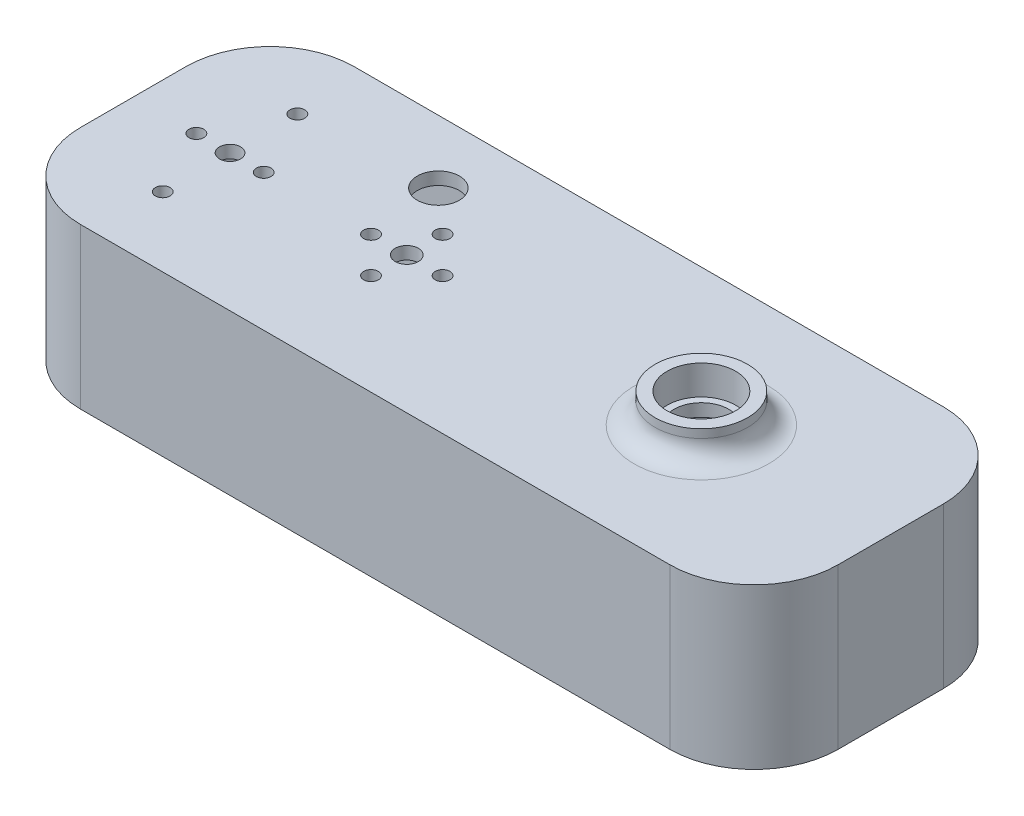
from build123d import *

# Parameters (mm, degrees)
SALIENTE_EXTRUIR1_DEPTH          = 35
SALIENTE_EXTRUIR2_DEPTH          = 35
CROQUIS3_W                       = 180
CROQUIS3_H                       = 65
SALIENTE_EXTRUIR3_DEPTH          = 3
REDONDEO1_R                      = 20
CROQUIS5_R                       = 2.5
CROQUIS5_R_2                     = 2.75
CORTAR_EXTRUIR1_DEPTH            = 3
CORTAR_EXTRUIR3_REACH            = 103.888
CROQUIS7_R                       = 1.75
TALADRO_DE_MARGEN_PARA_M31_D     = 3.4
TALADRO_DE_MARGEN_PARA_M31_DEPTH = 30
TALADRO_DE_MARGEN_PARA_M31_TIP   = 1.021463052
CORTAR_EXTRUIR4_REACH            = 104.958
CROQUIS10_R                      = 1.75
CROQUIS11_R                      = 5
CORTAR_EXTRUIR5_DEPTH            = 10
CROQUIS12_R                      = 6.5
CORTAR_EXTRUIR6_DEPTH            = 10
CROQUIS13_R                      = 11
CROQUIS13_R_2                    = 8.15
SALIENTE_EXTRUIR4_DEPTH          = 7
REDONDEO2_R                      = 5


with BuildPart() as part:
    # Croquis1 → Saliente-Extruir1 (new body)
    with BuildSketch(Plane(origin=(0, 0, 0), x_dir=(1, 0, 0), z_dir=(0, 1, 0))):
        Polygon((90, -32.5), (90, 0), (87, 0), (87, -29.5), (-87, -29.5), (-87, 0), (-90, 0), (-90, -32.5), align=None)
        Polygon((87, 0), (90, 0), (90, 32.5), (-90, 32.5), (-90, 0), (-87, 0), (-87, 29.5), (87, 29.5), align=None)
    extrude(amount=SALIENTE_EXTRUIR1_DEPTH)

    # Croquis2 → Saliente-Extruir2 (add)
    with BuildSketch(Plane(origin=(0, 35, 0), x_dir=(1, 0, 0), z_dir=(0, 1, 0))):
        Polygon((87, 29.5), (67, 29.5), (87, 9.5), align=None)
        Polygon((-67, 29.5), (-87, 9.5), (-87, 29.5), align=None)
        Polygon((67, -29.5), (87, -9.5), (87, -29.5), align=None)
        Polygon((-87, -29.5), (-67, -29.5), (-87, -9.5), align=None)
    extrude(amount=-SALIENTE_EXTRUIR2_DEPTH)

    # Croquis3 → Saliente-Extruir3 (add)
    with BuildSketch(Plane(origin=(0, 35, 0), x_dir=(1, 0, 0), z_dir=(0, 1, 0))):
        Rectangle(CROQUIS3_W, CROQUIS3_H)
    extrude(amount=SALIENTE_EXTRUIR3_DEPTH)

    # Redondeo1
    redondeo1_edges = [part.edges().sort_by_distance(p)[0] for p in [
        (90, 19, -32.5),
        (90, 19, 32.5),
        (-90, 19, 32.5),
        (-90, 19, -32.5),
    ]]
    fillet(redondeo1_edges, radius=REDONDEO1_R)

    # Croquis5 → Cortar-Extruir1 (cut)
    with BuildSketch(Plane.XZ.offset(-35)):
        with Locations(Location((-67, 0, 0), (0, 0, 270))):
            Circle(CROQUIS5_R)
        with Locations(Location((-25, 0, 0), (0, 0, 270))):
            Circle(CROQUIS5_R_2)
        with Locations(Location((45, 0, 0), (0, 0, 270))):
            Circle(CROQUIS5_R_2)
    extrude(amount=-CORTAR_EXTRUIR1_DEPTH, mode=Mode.SUBTRACT)

    # Croquis7 → Cortar-Extruir3 (cut, up to next)
    with BuildSketch(Plane.XZ.offset(-35), mode=Mode.PRIVATE) as cortar_extruir3_sk1:
        with Locations(Location((-67, 16, 0), (0, 0, 270))):
            Circle(CROQUIS7_R)
    cortar_extruir3_tool1 = extrude(cortar_extruir3_sk1.sketch, amount=-CORTAR_EXTRUIR3_REACH, mode=Mode.PRIVATE) & part.part
    # Croquis7 → Cortar-Extruir3 (cut, up to next)
    with BuildSketch(Plane.XZ.offset(-35), mode=Mode.PRIVATE) as cortar_extruir3_sk2:
        with Locations(Location((-59, 0, 0), (0, 0, 270))):
            Circle(CROQUIS7_R)
    cortar_extruir3_tool2 = extrude(cortar_extruir3_sk2.sketch, amount=-CORTAR_EXTRUIR3_REACH, mode=Mode.PRIVATE) & part.part
    # Croquis7 → Cortar-Extruir3 (cut, up to next)
    with BuildSketch(Plane.XZ.offset(-35), mode=Mode.PRIVATE) as cortar_extruir3_sk3:
        with Locations(Location((-67, -16, 0), (0, 0, 270))):
            Circle(CROQUIS7_R)
    cortar_extruir3_tool3 = extrude(cortar_extruir3_sk3.sketch, amount=-CORTAR_EXTRUIR3_REACH, mode=Mode.PRIVATE) & part.part
    # Croquis7 → Cortar-Extruir3 (cut, up to next)
    with BuildSketch(Plane.XZ.offset(-35), mode=Mode.PRIVATE) as cortar_extruir3_sk4:
        with Locations(Location((-75, 0, 0), (0, 0, 270))):
            Circle(CROQUIS7_R)
    cortar_extruir3_tool4 = extrude(cortar_extruir3_sk4.sketch, amount=-CORTAR_EXTRUIR3_REACH, mode=Mode.PRIVATE) & part.part
    add(cortar_extruir3_tool1.solids().sort_by_distance((-67, 35, 16))[0], mode=Mode.SUBTRACT)
    add(cortar_extruir3_tool2.solids().sort_by_distance((-59, 35, 0))[0], mode=Mode.SUBTRACT)
    add(cortar_extruir3_tool3.solids().sort_by_distance((-67, 35, -16))[0], mode=Mode.SUBTRACT)
    add(cortar_extruir3_tool4.solids().sort_by_distance((-75, 35, 0))[0], mode=Mode.SUBTRACT)

    # Taladro de margen para M31
    with Locations(Plane.XZ):
        with Locations((-80, 22.5), (80, 22.5), (-80, -22.5), (80, -22.5)):
            Hole(TALADRO_DE_MARGEN_PARA_M31_D / 2, depth=TALADRO_DE_MARGEN_PARA_M31_DEPTH)
            with Locations((0, 0, -(TALADRO_DE_MARGEN_PARA_M31_DEPTH + TALADRO_DE_MARGEN_PARA_M31_TIP / 2))):  # 118° drill point
                Cone(0, TALADRO_DE_MARGEN_PARA_M31_D / 2, TALADRO_DE_MARGEN_PARA_M31_TIP, mode=Mode.SUBTRACT)

    # Croquis10 → Cortar-Extruir4 (cut, up to next)
    with BuildSketch(Plane(origin=(0, 38, 0), x_dir=(1, 0, 0), z_dir=(0, 1, 0)), mode=Mode.PRIVATE) as cortar_extruir4_sk1:
        with Locations(Location((-25, 8.5, 0), (0, 0, 270))):
            Circle(CROQUIS10_R)
    cortar_extruir4_tool1 = extrude(cortar_extruir4_sk1.sketch, amount=-CORTAR_EXTRUIR4_REACH, mode=Mode.PRIVATE) & part.part
    # Croquis10 → Cortar-Extruir4 (cut, up to next)
    with BuildSketch(Plane(origin=(0, 38, 0), x_dir=(1, 0, 0), z_dir=(0, 1, 0)), mode=Mode.PRIVATE) as cortar_extruir4_sk2:
        with Locations(Location((-16.5, 0, 0), (0, 0, 270))):
            Circle(CROQUIS10_R)
    cortar_extruir4_tool2 = extrude(cortar_extruir4_sk2.sketch, amount=-CORTAR_EXTRUIR4_REACH, mode=Mode.PRIVATE) & part.part
    # Croquis10 → Cortar-Extruir4 (cut, up to next)
    with BuildSketch(Plane(origin=(0, 38, 0), x_dir=(1, 0, 0), z_dir=(0, 1, 0)), mode=Mode.PRIVATE) as cortar_extruir4_sk3:
        with Locations(Location((-25, -8.5, 0), (0, 0, 270))):
            Circle(CROQUIS10_R)
    cortar_extruir4_tool3 = extrude(cortar_extruir4_sk3.sketch, amount=-CORTAR_EXTRUIR4_REACH, mode=Mode.PRIVATE) & part.part
    # Croquis10 → Cortar-Extruir4 (cut, up to next)
    with BuildSketch(Plane(origin=(0, 38, 0), x_dir=(1, 0, 0), z_dir=(0, 1, 0)), mode=Mode.PRIVATE) as cortar_extruir4_sk4:
        with Locations(Location((-33.5, 0, 0), (0, 0, 270))):
            Circle(CROQUIS10_R)
    cortar_extruir4_tool4 = extrude(cortar_extruir4_sk4.sketch, amount=-CORTAR_EXTRUIR4_REACH, mode=Mode.PRIVATE) & part.part
    add(cortar_extruir4_tool1.solids().sort_by_distance((-25, 38, -8.5))[0], mode=Mode.SUBTRACT)
    add(cortar_extruir4_tool2.solids().sort_by_distance((-16.5, 38, 0))[0], mode=Mode.SUBTRACT)
    add(cortar_extruir4_tool3.solids().sort_by_distance((-25, 38, 8.5))[0], mode=Mode.SUBTRACT)
    add(cortar_extruir4_tool4.solids().sort_by_distance((-33.5, 38, 0))[0], mode=Mode.SUBTRACT)

    # Croquis11 → Cortar-Extruir5 (cut)
    with BuildSketch(Plane.XZ.offset(-35)):
        with Locations(Location((-35, -17.5, 0), (0, 0, 270))):
            Circle(CROQUIS11_R)
    extrude(amount=-CORTAR_EXTRUIR5_DEPTH, mode=Mode.SUBTRACT)

    # Croquis12 → Cortar-Extruir6 (cut)
    with BuildSketch(Plane(origin=(0, 38, 0), x_dir=(1, 0, 0), z_dir=(0, 1, 0))):
        with Locations(Location((45, 0, 0), (0, 0, 270))):
            Circle(CROQUIS12_R)
    extrude(amount=-CORTAR_EXTRUIR6_DEPTH, mode=Mode.SUBTRACT)

    # Croquis13 → Saliente-Extruir4 (add)
    with BuildSketch(Plane(origin=(0, 38, 0), x_dir=(1, 0, 0), z_dir=(0, 1, 0))):
        with Locations(Location((45, 0, 0), (0, 0, 90))):
            Circle(CROQUIS13_R)
        with Locations(Location((45, 0, 0), (0, 0, 270))):
            Circle(CROQUIS13_R_2, mode=Mode.SUBTRACT)
    extrude(amount=SALIENTE_EXTRUIR4_DEPTH)

    # Redondeo2
    redondeo2_edges = [part.edges().sort_by_distance(p)[0] for p in [
        (45, 38, 11),
    ]]
    fillet(redondeo2_edges, radius=REDONDEO2_R)


solid = part.part
